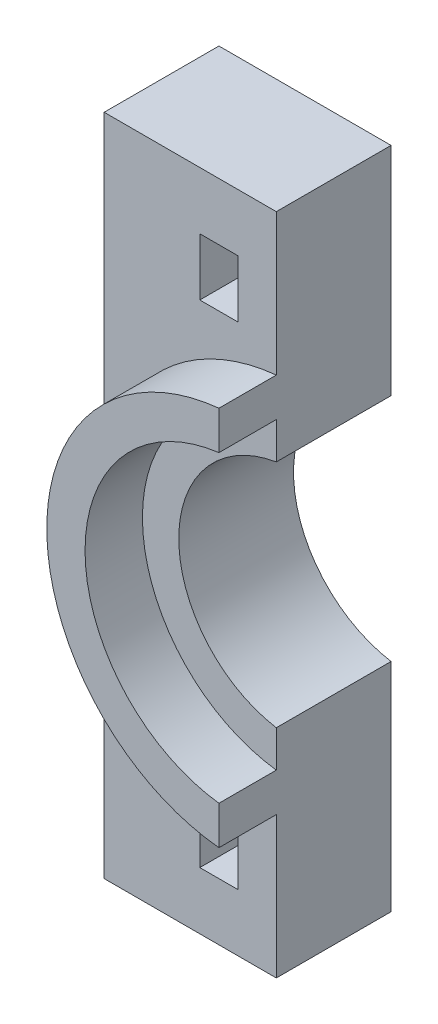
from build123d import *

# Parameters (mm, degrees)
SKETCH_1_W          = 2
SKETCH_1_H          = 3
EXTRUDE_1_DEPTH     = 6
EXTRUDE_2_DEPTH     = 3
SKETCH_3_W          = 1
SKETCH_3_H          = 34.7
CUT_EXTRUDE_1_DEPTH = 9


with BuildPart() as part:
    # 草圖1 → 填料-伸長1 (new body)
    with BuildSketch(Plane.XY):
        with BuildLine():
            Line((5, 17.35), (-5, 17.35))
            Line((-5, 17.35), (-5, -17.35))
            Line((-5, -17.35), (5, -17.35))
            Line((5, -17.35), (5, -6.1))
            ThreePointArc((5, -6.1), (-1.1, 0), (5, 6.1))
            Line((5, 6.1), (5, 17.35))
        make_face()
        with Locations((1, -12.85)):
            Rectangle(SKETCH_1_W, SKETCH_1_H, mode=Mode.SUBTRACT)
        with Locations((1, 12.85)):
            Rectangle(SKETCH_1_W, SKETCH_1_H, mode=Mode.SUBTRACT)
    extrude(amount=EXTRUDE_1_DEPTH)

    # 草圖2 → 填料-伸長2 (add)
    with BuildSketch(Plane.XY.offset(6)):
        with BuildLine():
            Line((5, 10), (5, 8))
            ThreePointArc((5, 8), (-3, 0), (5, -8))
            Line((5, -8), (5, -10))
            ThreePointArc((5, -10), (-5, 0), (5, 10))
        make_face()
    extrude(amount=EXTRUDE_2_DEPTH)

    # 草圖3 → 除料-伸長1 (cut, symmetric)
    with BuildSketch(Plane.XY.offset(6)):
        with Locations((4.5, 0)):
            Rectangle(SKETCH_3_W, SKETCH_3_H)
    extrude(amount=CUT_EXTRUDE_1_DEPTH, both=True, mode=Mode.SUBTRACT)


solid = part.part
